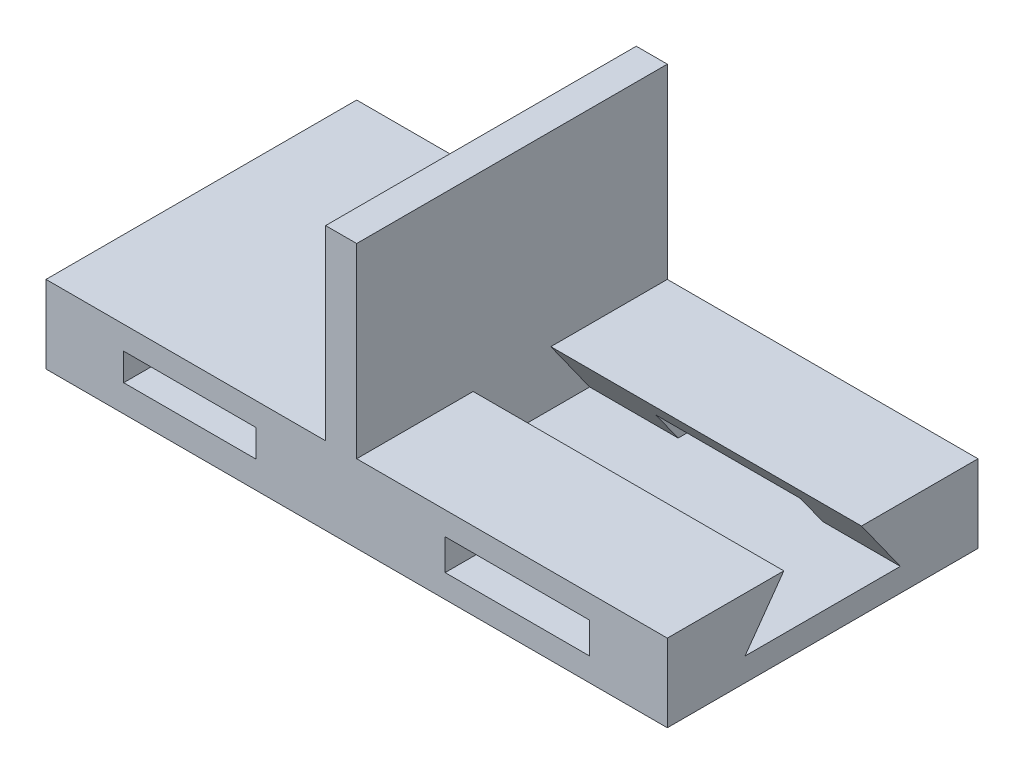
from build123d import *

# Parameters (mm, degrees)
SKETCH3_W                = 20
SKETCH3_H                = 12
BOSS_EXTRUDE3_DEPTH      = 2
BOSS_EXTRUDE5_DEPTH      = 20
BOSS_EXTRUDE5_DEPTH_BACK = 20
SKETCH4_W                = 20
SKETCH4_H                = 5
CUT_EXTRUDE1_DEPTH       = 20
SKETCH7_W                = 8.512199936
SKETCH7_H                = 1.761144814
SKETCH7_W_2              = 9.304715103
SKETCH7_H_2              = 2
CUT_EXTRUDE2_DEPTH       = 35.249087579


with BuildPart() as part:
    # Sketch3 → Boss-Extrude3 (new body)
    with BuildSketch(Plane(origin=(0, 0, 0), x_dir=(0, 0, -1), z_dir=(1, 0, 0))):
        with Locations((10, -6)):
            Rectangle(SKETCH3_W, SKETCH3_H)
    extrude(amount=BOSS_EXTRUDE3_DEPTH)

    # Sketch4 → Boss-Extrude5 (add, two sides: drawn at the far end of the back side and taken through both)
    with BuildSketch(Plane(origin=(2, 0, 0), x_dir=(0, 0, -1), z_dir=(1, 0, 0)).offset(-BOSS_EXTRUDE5_DEPTH_BACK)):
        with Locations((10, -14.5)):
            Rectangle(SKETCH4_W, SKETCH4_H)
    extrude(amount=BOSS_EXTRUDE5_DEPTH + BOSS_EXTRUDE5_DEPTH_BACK)

    # Sketch6 → Cut-Extrude1 (cut)
    with BuildSketch(Plane(origin=(22, 0, 0), x_dir=(0, 0, -1), z_dir=(1, 0, 0))):
        Polygon((7.5, -12), (12.5, -12), (15, -15.5), (5, -15.5), align=None)
    extrude(amount=-CUT_EXTRUDE1_DEPTH, mode=Mode.SUBTRACT)

    # Sketch7 → Cut-Extrude2 (cut, through all)
    with BuildSketch(Plane(origin=(0, 0, -20), x_dir=(-1, 0, 0), z_dir=(0, 0, -1))):
        with Locations((8.743900032, -14.380572407)):
            Rectangle(SKETCH7_W, SKETCH7_H)
        with Locations((-12.347642449, -14.5)):
            Rectangle(SKETCH7_W_2, SKETCH7_H_2)
    extrude(amount=-CUT_EXTRUDE2_DEPTH, mode=Mode.SUBTRACT)


solid = part.part
